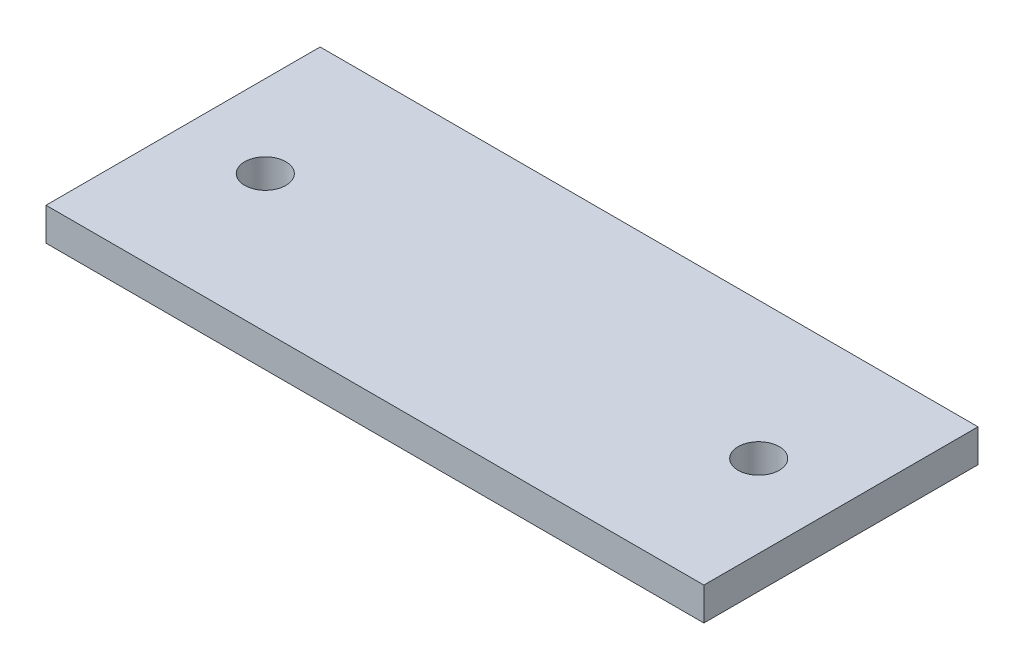
from build123d import *

# Parameters (mm, degrees)
SKETCH2_W           = 304.8
SKETCH2_H           = 127
SKETCH2_R           = 9.525
BOSS_EXTRUDE1_DEPTH = 15.24


with BuildPart() as part:
    # Sketch2 → Boss-Extrude1 (new body)
    with BuildSketch(Plane(origin=(0, 0, 0), x_dir=(1, 0, 0), z_dir=(0, 1, 0))):
        with Locations((152.4, -63.5)):
            Rectangle(SKETCH2_W, SKETCH2_H)
        with Locations(Location((38.1, -63.5, 0), (0, 0, 90))):
            Circle(SKETCH2_R, mode=Mode.SUBTRACT)
        with Locations(Location((266.7, -63.5, 0), (0, 0, 90))):
            Circle(SKETCH2_R, mode=Mode.SUBTRACT)
    extrude(amount=BOSS_EXTRUDE1_DEPTH)


solid = part.part
